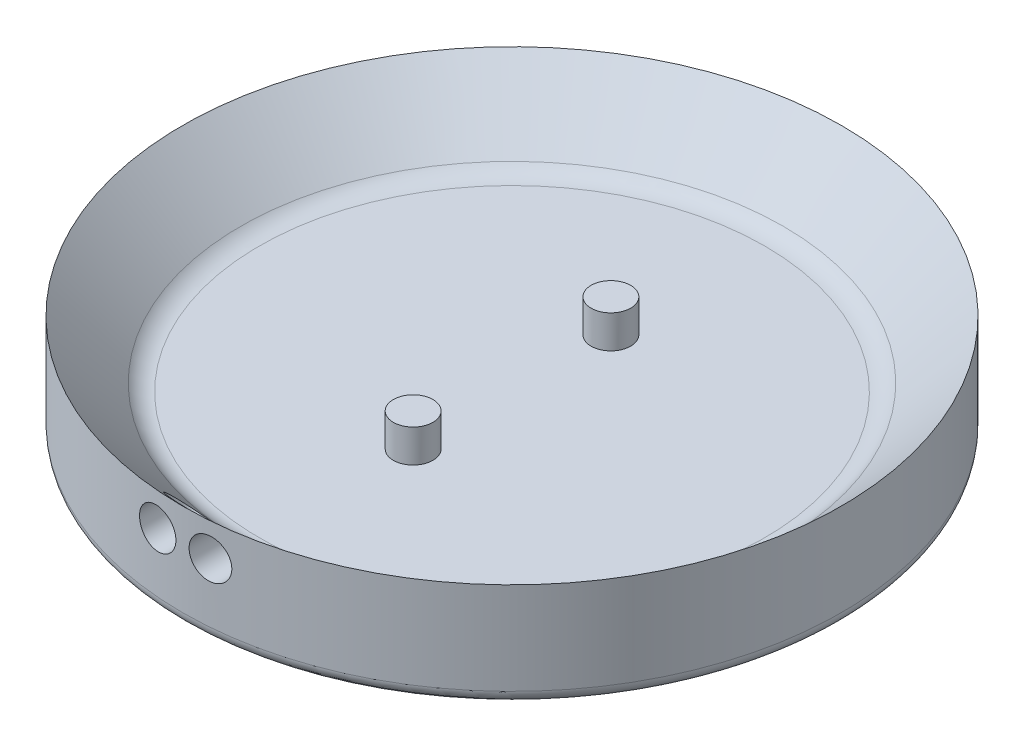
from build123d import *

# Parameters (mm, degrees)
CUT_EXTRUDE1_REACH  = 58.471
SKETCH5_R           = 1.5
SKETCH6_R           = 1.5
BOSS_EXTRUDE1_DEPTH = 2.5


with BuildPart() as part:
    # Sketch3 → Revolve3 (revolve)
    with BuildSketch(Plane.XY, mode=Mode.PRIVATE) as revolve3_sk:
        with BuildLine():
            Line((-23, 0), (0, 0))
            Line((0, 0), (0, 3))
            Line((0, 3), (-19.171572875, 3))
            ThreePointArc((-19.171572875, 3), (-19.93693974, 3.152240935), (-20.585786438, 3.585786438))
            Line((-20.585786438, 3.585786438), (-25, 8))
            Line((-25, 8), (-25, 1))
            ThreePointArc((-25, 1), (-24.707106781, 0.292893219), (-24, 0))
            Line((-24, 0), (-23, 0))
        make_face()
    revolve(revolve3_sk.sketch.rotate(Axis((0, 0, 0), (0, 1, 0)), 270), axis=Axis((0, 0, 0), (0, 1, 0)))

    # Cut-Extrude1: up to this cone (the profile starts outside it)
    cut_extrude1_end = Plane(origin=(0, 5.5, 0), z_dir=(0, 1, 0)).offset(-22.499999) * Cone(1e-06, 103.971, 103.970999, align=(Align.CENTER, Align.CENTER, Align.MIN), mode=Mode.PRIVATE)
    # Sketch5 → Cut-Extrude1 (cut, up to the surface)
    with BuildSketch(Plane.XY.offset(25), mode=Mode.PRIVATE) as cut_extrude1_sk1:
        with Locations((-2, 5.5)):
            Circle(SKETCH5_R)
    cut_extrude1_tool1 = extrude(cut_extrude1_sk1.sketch, amount=-CUT_EXTRUDE1_REACH, mode=Mode.PRIVATE) - cut_extrude1_end
    add(cut_extrude1_tool1.solids().sort_by_distance((-2, 5.5, 25))[0], mode=Mode.SUBTRACT)
    # Sketch5 → Cut-Extrude1 (cut, up to the surface)
    with BuildSketch(Plane.XY.offset(25), mode=Mode.PRIVATE) as cut_extrude1_sk2:
        with Locations((2, 5.5)):
            Circle(SKETCH5_R)
    cut_extrude1_tool2 = extrude(cut_extrude1_sk2.sketch, amount=-CUT_EXTRUDE1_REACH, mode=Mode.PRIVATE) - cut_extrude1_end
    add(cut_extrude1_tool2.solids().sort_by_distance((2, 5.5, 25))[0], mode=Mode.SUBTRACT)

    # Sketch6 → Boss-Extrude1 (add)
    with BuildSketch(Plane(origin=(0, 3, 0), x_dir=(1, 0, 0), z_dir=(0, 1, 0))):
        with Locations(Location((0, 7.5, 0), (0, 0, 90))):
            Circle(SKETCH6_R)
        with Locations(Location((0, -7.5, 0), (0, 0, 90))):
            Circle(SKETCH6_R)
    extrude(amount=BOSS_EXTRUDE1_DEPTH)


solid = part.part
